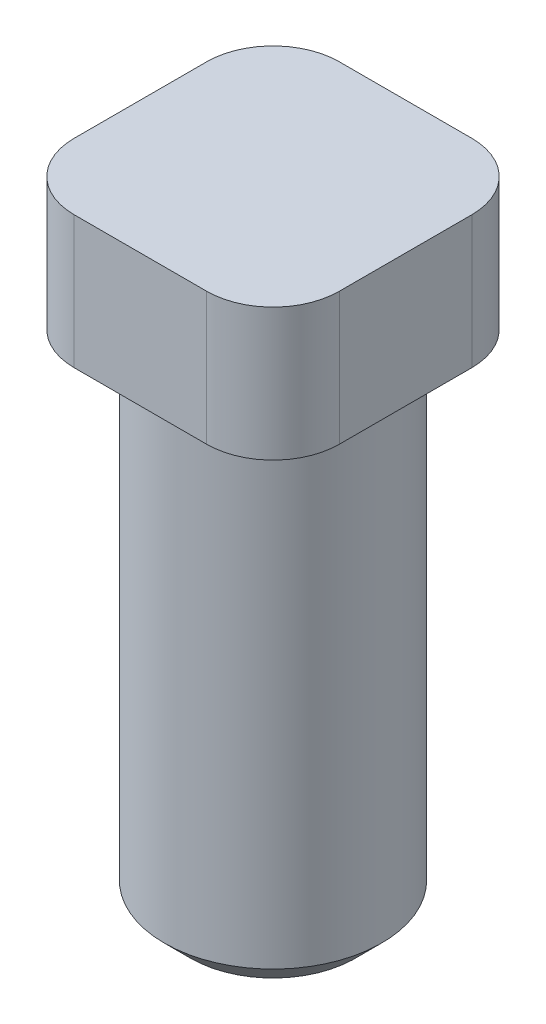
from build123d import *

# Parameters (mm, degrees)
SKETCH1_R           = 4.1
BOSS_EXTRUDE1_DEPTH = 19
SKETCH2_W           = 10
SKETCH2_H           = 10
BOSS_EXTRUDE2_DEPTH = 5
FILLET1_R           = 2.5
CHAMFER1_SIZE       = 1


with BuildPart() as part:
    # Sketch1 → Boss-Extrude1 (new body)
    with BuildSketch(Plane(origin=(0, 0, 0), x_dir=(1, 0, 0), z_dir=(0, 1, 0))):
        with Locations(Location((0, 0, 0), (0, 0, 270))):
            Circle(SKETCH1_R)
    extrude(amount=BOSS_EXTRUDE1_DEPTH)

    # Sketch2 → Boss-Extrude2 (add)
    with BuildSketch(Plane(origin=(0, 19, 0), x_dir=(1, 0, 0), z_dir=(0, 1, 0))):
        Rectangle(SKETCH2_W, SKETCH2_H)
    extrude(amount=BOSS_EXTRUDE2_DEPTH)

    # Fillet1
    fillet1_edges = [part.edges().sort_by_distance(p)[0] for p in [
        (5, 21.5, 5),
        (5, 21.5, -5),
        (-5, 21.5, -5),
        (-5, 21.5, 5),
    ]]
    fillet(fillet1_edges, radius=FILLET1_R)

    # Chamfer1
    chamfer1_edges = [part.edges().sort_by_distance(p)[0] for p in [
        (0, 0, -4.1),
    ]]
    chamfer(chamfer1_edges, length=CHAMFER1_SIZE)


solid = part.part
